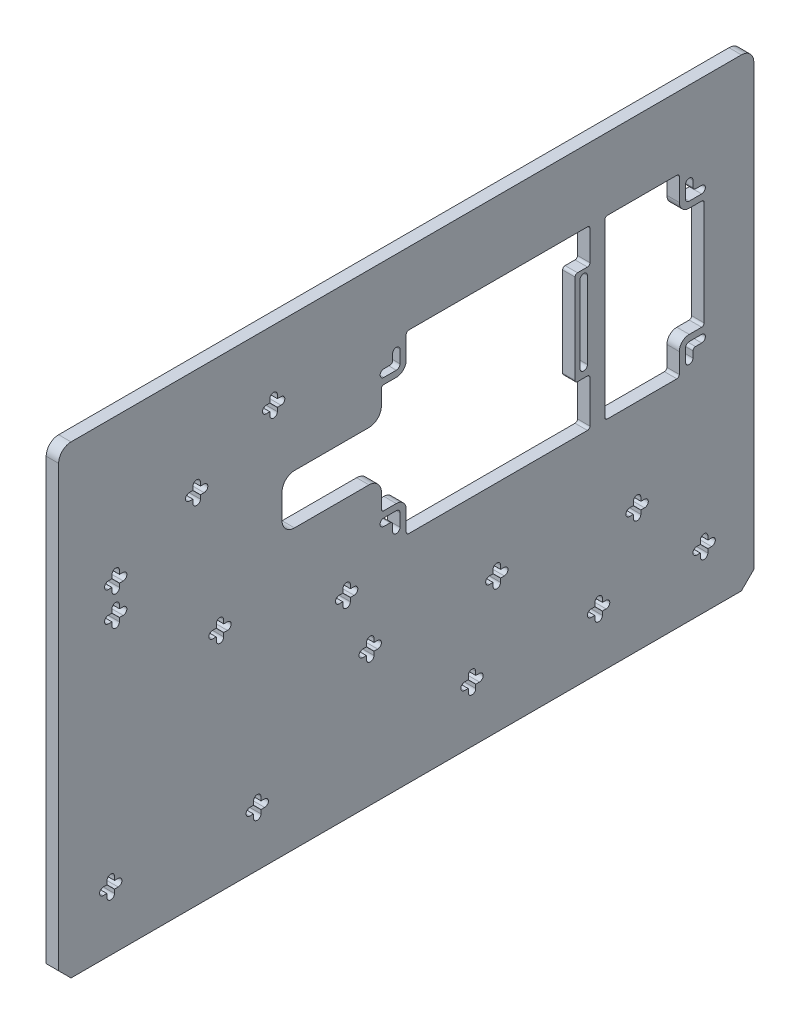
from build123d import *

# Parameters (mm, degrees)
BOSS_EXTRUDE1_DEPTH = 2.5


with BuildPart() as part:
    # Sketch1 → Boss-Extrude1 (new, symmetric)
    with BuildSketch(Plane(origin=(0, 0, 0), x_dir=(0, -1, 0), z_dir=(1, 0, 0))):
        with BuildLine():
            Line((-93.5, 135), (-93.5, -135))
            ThreePointArc((-93.5, -135), (-92.035533906, -138.535533906), (-88.5, -140))
            Line((-88.5, -140), (88.5, -140))
            Line((88.5, -140), (93.5, -135))
            Line((93.5, -135), (93.5, 135))
            Line((93.5, 135), (88.5, 140))
            Line((88.5, 140), (-88.5, 140))
            ThreePointArc((-88.5, 140), (-92.035533906, 138.535533906), (-93.5, 135))
        make_face()
        with BuildLine():
            Line((-12.5, 73), (-12.5, 69))
            ThreePointArc((-12.5, 69), (-12.792893219, 68.292893219), (-13.5, 68))
            Line((-13.5, 68), (-49.5, 68))
            ThreePointArc((-49.5, 68), (-50.207106781, 68.292893219), (-50.5, 69))
            Line((-50.5, 69), (-50.5, 73))
            ThreePointArc((-50.5, 73), (-50.792893219, 73.707106781), (-51.5, 74))
            Line((-51.5, 74), (-63.5, 74))
            ThreePointArc((-63.5, 74), (-64.207106781, 73.707106781), (-64.5, 73))
            Line((-64.5, 73), (-64.5, 1))
            ThreePointArc((-64.5, 1), (-64.207106781, 0.292893219), (-63.5, 0))
            Line((-63.5, 0), (-54.5, 0))
            ThreePointArc((-54.5, 0), (-51.671572875, -1.171572875), (-50.5, -4))
            Line((-50.5, -4), (-50.5, -9))
            ThreePointArc((-50.5, -9), (-50.207106781, -9.707106781), (-49.5, -10))
            Line((-49.5, -10), (-43.5, -10))
            ThreePointArc((-43.5, -10), (-39.964466094, -11.464466094), (-38.5, -15))
            Line((-38.5, -15), (-38.5, -45))
            ThreePointArc((-38.5, -45), (-37.035533906, -48.535533906), (-33.5, -50))
            Line((-33.5, -50), (-23.5, -50))
            ThreePointArc((-23.5, -50), (-19.964466094, -48.535533906), (-18.5, -45))
            Line((-18.5, -45), (-18.5, -15))
            ThreePointArc((-18.5, -15), (-17.035533906, -11.464466094), (-13.5, -10))
            Line((-13.5, -10), (-7.5, -10))
            ThreePointArc((-7.5, -10), (-6.792893219, -9.707106781), (-6.5, -9))
            Line((-6.5, -9), (-6.5, -4))
            ThreePointArc((-6.5, -4), (-5.328427125, -1.171572875), (-2.5, 0))
            Line((-2.5, 0), (5.5, 0))
            ThreePointArc((5.5, 0), (6.207106781, 0.292893219), (6.5, 1))
            Line((6.5, 1), (6.5, 73))
            ThreePointArc((6.5, 73), (6.207106781, 73.707106781), (5.5, 74))
            Line((5.5, 74), (-11.5, 74))
            ThreePointArc((-11.5, 74), (-12.207106781, 73.707106781), (-12.5, 73))
        make_face(mode=Mode.SUBTRACT)
        with BuildLine():
            Line((-47.5, 120), (-49.5, 120))
            ThreePointArc((-49.5, 120), (-50.207106781, 119.707106781), (-50.5, 119))
            Line((-50.5, 119), (-50.5, 114))
            ThreePointArc((-50.5, 114), (-51.671572875, 111.171572875), (-54.5, 110))
            Line((-54.5, 110), (-63.5, 110))
            ThreePointArc((-63.5, 110), (-64.207106781, 109.707106781), (-64.5, 109))
            Line((-64.5, 109), (-64.5, 81))
            ThreePointArc((-64.5, 81), (-64.207106781, 80.292893219), (-63.5, 80))
            Line((-63.5, 80), (5.5, 80))
            ThreePointArc((5.5, 80), (6.207106781, 80.292893219), (6.5, 81))
            Line((6.5, 81), (6.5, 109))
            ThreePointArc((6.5, 109), (6.207106781, 109.707106781), (5.5, 110))
            Line((5.5, 110), (-2.5, 110))
            ThreePointArc((-2.5, 110), (-5.328427125, 111.171572875), (-6.5, 114))
            Line((-6.5, 114), (-6.5, 119))
            ThreePointArc((-6.5, 119), (-6.792893219, 119.707106781), (-7.5, 120))
            Line((-7.5, 120), (-28.5, 120))
            Line((-28.5, 120), (-47.5, 120))
        make_face(mode=Mode.SUBTRACT)
        with BuildLine():
            Line((-47.5, 73), (-16.5, 73))
            ThreePointArc((-16.5, 73), (-15, 71.5), (-16.5, 70))
            Line((-16.5, 70), (-47.5, 70))
            ThreePointArc((-47.5, 70), (-49, 71.5), (-47.5, 73))
        make_face(mode=Mode.SUBTRACT)
        with BuildLine():
            Line((-4, 119), (-4, 114))
            ThreePointArc((-4, 114), (-3.560660172, 112.939339828), (-2.5, 112.5))
            Line((-2.5, 112.5), (2.5, 112.5))
            ThreePointArc((2.5, 112.5), (4, 114), (2.5, 115.5))
            Line((2.5, 115.5), (0, 115.5))
            ThreePointArc((0, 115.5), (-0.707106781, 115.792893219), (-1, 116.5))
            Line((-1, 116.5), (-1, 119))
            ThreePointArc((-1, 119), (-2.5, 120.5), (-4, 119))
        make_face(mode=Mode.SUBTRACT)
        with BuildLine():
            Line((-53, 119), (-53, 114))
            ThreePointArc((-53, 114), (-53.439339828, 112.939339828), (-54.5, 112.5))
            Line((-54.5, 112.5), (-59.5, 112.5))
            ThreePointArc((-59.5, 112.5), (-61, 114), (-59.5, 115.5))
            Line((-59.5, 115.5), (-57, 115.5))
            ThreePointArc((-57, 115.5), (-56.292893219, 115.792893219), (-56, 116.5))
            Line((-56, 116.5), (-56, 119))
            ThreePointArc((-56, 119), (-54.5, 120.5), (-53, 119))
        make_face(mode=Mode.SUBTRACT)
        with BuildLine():
            Line((-54.5, -2.5), (-59.5, -2.5))
            ThreePointArc((-59.5, -2.5), (-61, -4), (-59.5, -5.5))
            Line((-59.5, -5.5), (-57, -5.5))
            ThreePointArc((-57, -5.5), (-56.292893219, -5.792893219), (-56, -6.5))
            Line((-56, -6.5), (-56, -9))
            ThreePointArc((-56, -9), (-54.5, -10.5), (-53, -9))
            Line((-53, -9), (-53, -4))
            ThreePointArc((-53, -4), (-53.439339828, -2.939339828), (-54.5, -2.5))
        make_face(mode=Mode.SUBTRACT)
        with BuildLine():
            Line((2.5, -2.5), (-2.5, -2.5))
            ThreePointArc((-2.5, -2.5), (-3.560660172, -2.939339828), (-4, -4))
            Line((-4, -4), (-4, -9))
            ThreePointArc((-4, -9), (-2.5, -10.5), (-1, -9))
            Line((-1, -9), (-1, -6.5))
            ThreePointArc((-1, -6.5), (-0.707106781, -5.792893219), (0, -5.5))
            Line((0, -5.5), (2.5, -5.5))
            ThreePointArc((2.5, -5.5), (4, -4), (2.5, -2.5))
        make_face(mode=Mode.SUBTRACT)
        with BuildLine():
            Line((36, -13), (37.45, -13))
            ThreePointArc((37.45, -13), (37.485355339, -12.985355339), (37.5, -12.95))
            Line((37.5, -12.95), (37.5, -11.5))
            ThreePointArc((37.5, -11.5), (39, -10), (40.5, -11.5))
            Line((40.5, -11.5), (40.5, -12.95))
            ThreePointArc((40.5, -12.95), (40.514644661, -12.985355339), (40.55, -13))
            Line((40.55, -13), (42, -13))
            ThreePointArc((42, -13), (43.5, -14.5), (42, -16))
            Line((42, -16), (40.55, -16))
            ThreePointArc((40.55, -16), (40.514644661, -16.014644661), (40.5, -16.05))
            Line((40.5, -16.05), (40.5, -17.5))
            ThreePointArc((40.5, -17.5), (39, -19), (37.5, -17.5))
            Line((37.5, -17.5), (37.5, -16.05))
            ThreePointArc((37.5, -16.05), (37.485355339, -16.014644661), (37.45, -16))
            Line((37.45, -16), (36, -16))
            ThreePointArc((36, -16), (34.5, -14.5), (36, -13))
        make_face(mode=Mode.SUBTRACT)
        with BuildLine():
            Line((68, 28), (69.45, 28))
            ThreePointArc((69.45, 28), (69.485355339, 28.014644661), (69.5, 28.05))
            Line((69.5, 28.05), (69.5, 29.5))
            ThreePointArc((69.5, 29.5), (71, 31), (72.5, 29.5))
            Line((72.5, 29.5), (72.5, 28.05))
            ThreePointArc((72.5, 28.05), (72.514644661, 28.014644661), (72.55, 28))
            Line((72.55, 28), (74, 28))
            ThreePointArc((74, 28), (75.5, 26.5), (74, 25))
            Line((74, 25), (72.55, 25))
            ThreePointArc((72.55, 25), (72.514644661, 24.985355339), (72.5, 24.95))
            Line((72.5, 24.95), (72.5, 23.5))
            ThreePointArc((72.5, 23.5), (71, 22), (69.5, 23.5))
            Line((69.5, 23.5), (69.5, 24.95))
            ThreePointArc((69.5, 24.95), (69.485355339, 24.985355339), (69.45, 25))
            Line((69.45, 25), (68, 25))
            ThreePointArc((68, 25), (66.5, 26.5), (68, 28))
        make_face(mode=Mode.SUBTRACT)
        with BuildLine():
            Line((17, -21), (17, -22.45))
            ThreePointArc((17, -22.45), (17.014644661, -22.485355339), (17.05, -22.5))
            Line((17.05, -22.5), (18.5, -22.5))
            ThreePointArc((18.5, -22.5), (20, -24), (18.5, -25.5))
            Line((18.5, -25.5), (17.05, -25.5))
            ThreePointArc((17.05, -25.5), (17.014644661, -25.514644661), (17, -25.55))
            Line((17, -25.55), (17, -27))
            ThreePointArc((17, -27), (15.5, -28.5), (14, -27))
            Line((14, -27), (14, -25.55))
            ThreePointArc((14, -25.55), (13.985355339, -25.514644661), (13.95, -25.5))
            Line((13.95, -25.5), (12.5, -25.5))
            ThreePointArc((12.5, -25.5), (11, -24), (12.5, -22.5))
            Line((12.5, -22.5), (13.95, -22.5))
            ThreePointArc((13.95, -22.5), (13.985355339, -22.485355339), (14, -22.45))
            Line((14, -22.45), (14, -21))
            ThreePointArc((14, -21), (15.5, -19.5), (17, -21))
        make_face(mode=Mode.SUBTRACT)
        with BuildLine():
            Line((73, -57), (73, -58.45))
            ThreePointArc((73, -58.45), (73.014644661, -58.485355339), (73.05, -58.5))
            Line((73.05, -58.5), (74.5, -58.5))
            ThreePointArc((74.5, -58.5), (76, -60), (74.5, -61.5))
            Line((74.5, -61.5), (73.05, -61.5))
            ThreePointArc((73.05, -61.5), (73.014644661, -61.514644661), (73, -61.55))
            Line((73, -61.55), (73, -63))
            ThreePointArc((73, -63), (71.5, -64.5), (70, -63))
            Line((70, -63), (70, -61.55))
            ThreePointArc((70, -61.55), (69.985355339, -61.514644661), (69.95, -61.5))
            Line((69.95, -61.5), (68.5, -61.5))
            ThreePointArc((68.5, -61.5), (67, -60), (68.5, -58.5))
            Line((68.5, -58.5), (69.95, -58.5))
            ThreePointArc((69.95, -58.5), (69.985355339, -58.485355339), (70, -58.45))
            Line((70, -58.45), (70, -57))
            ThreePointArc((70, -57), (71.5, -55.5), (73, -57))
        make_face(mode=Mode.SUBTRACT)
        with BuildLine():
            Line((40.5, 94.5), (41.95, 94.5))
            ThreePointArc((41.95, 94.5), (41.985355339, 94.514644661), (42, 94.55))
            Line((42, 94.55), (42, 96))
            ThreePointArc((42, 96), (43.5, 97.5), (45, 96))
            Line((45, 96), (45, 94.55))
            ThreePointArc((45, 94.55), (45.014644661, 94.514644661), (45.05, 94.5))
            Line((45.05, 94.5), (46.5, 94.5))
            ThreePointArc((46.5, 94.5), (48, 93), (46.5, 91.5))
            Line((46.5, 91.5), (45.05, 91.5))
            ThreePointArc((45.05, 91.5), (45.014644661, 91.485355339), (45, 91.45))
            Line((45, 91.45), (45, 90))
            ThreePointArc((45, 90), (43.5, 88.5), (42, 90))
            Line((42, 90), (42, 91.45))
            ThreePointArc((42, 91.45), (41.985355339, 91.485355339), (41.95, 91.5))
            Line((41.95, 91.5), (40.5, 91.5))
            ThreePointArc((40.5, 91.5), (39, 93), (40.5, 94.5))
        make_face(mode=Mode.SUBTRACT)
        with BuildLine():
            Line((67.5, 121.5), (68.95, 121.5))
            ThreePointArc((68.95, 121.5), (68.985355339, 121.514644661), (69, 121.55))
            Line((69, 121.55), (69, 123))
            ThreePointArc((69, 123), (70.5, 124.5), (72, 123))
            Line((72, 123), (72, 121.55))
            ThreePointArc((72, 121.55), (72.014644661, 121.514644661), (72.05, 121.5))
            Line((72.05, 121.5), (73.5, 121.5))
            ThreePointArc((73.5, 121.5), (75, 120), (73.5, 118.5))
            Line((73.5, 118.5), (72.05, 118.5))
            ThreePointArc((72.05, 118.5), (72.014644661, 118.485355339), (72, 118.45))
            Line((72, 118.45), (72, 117))
            ThreePointArc((72, 117), (70.5, 115.5), (69, 117))
            Line((69, 117), (69, 118.45))
            ThreePointArc((69, 118.45), (68.985355339, 118.485355339), (68.95, 118.5))
            Line((68.95, 118.5), (67.5, 118.5))
            ThreePointArc((67.5, 118.5), (66, 120), (67.5, 121.5))
        make_face(mode=Mode.SUBTRACT)
        with BuildLine():
            Line((-34.5, -120), (-34.5, -118.55))
            ThreePointArc((-34.5, -118.55), (-34.485355339, -118.514644661), (-34.45, -118.5))
            Line((-34.45, -118.5), (-33, -118.5))
            ThreePointArc((-33, -118.5), (-31.5, -117), (-33, -115.5))
            Line((-33, -115.5), (-34.45, -115.5))
            ThreePointArc((-34.45, -115.5), (-34.485355339, -115.485355339), (-34.5, -115.45))
            Line((-34.5, -115.45), (-34.5, -114))
            ThreePointArc((-34.5, -114), (-36, -112.5), (-37.5, -114))
            Line((-37.5, -114), (-37.5, -115.45))
            ThreePointArc((-37.5, -115.45), (-37.514644661, -115.485355339), (-37.55, -115.5))
            Line((-37.55, -115.5), (-39, -115.5))
            ThreePointArc((-39, -115.5), (-40.5, -117), (-39, -118.5))
            Line((-39, -118.5), (-37.55, -118.5))
            ThreePointArc((-37.55, -118.5), (-37.514644661, -118.514644661), (-37.5, -118.55))
            Line((-37.5, -118.55), (-37.5, -120))
            ThreePointArc((-37.5, -120), (-36, -121.5), (-34.5, -120))
        make_face(mode=Mode.SUBTRACT)
        with BuildLine():
            Line((-22.5, -120), (-22.5, -118.55))
            ThreePointArc((-22.5, -118.55), (-22.485355339, -118.514644661), (-22.45, -118.5))
            Line((-22.45, -118.5), (-21, -118.5))
            ThreePointArc((-21, -118.5), (-19.5, -117), (-21, -115.5))
            Line((-21, -115.5), (-22.45, -115.5))
            ThreePointArc((-22.45, -115.5), (-22.485355339, -115.485355339), (-22.5, -115.45))
            Line((-22.5, -115.45), (-22.5, -114))
            ThreePointArc((-22.5, -114), (-24, -112.5), (-25.5, -114))
            Line((-25.5, -114), (-25.5, -115.45))
            ThreePointArc((-25.5, -115.45), (-25.514644661, -115.485355339), (-25.55, -115.5))
            Line((-25.55, -115.5), (-27, -115.5))
            ThreePointArc((-27, -115.5), (-28.5, -117), (-27, -118.5))
            Line((-27, -118.5), (-25.55, -118.5))
            ThreePointArc((-25.55, -118.5), (-25.514644661, -118.514644661), (-25.5, -118.55))
            Line((-25.5, -118.55), (-25.5, -120))
            ThreePointArc((-25.5, -120), (-24, -121.5), (-22.5, -120))
        make_face(mode=Mode.SUBTRACT)
        with BuildLine():
            Line((36, 38), (37.45, 38))
            ThreePointArc((37.45, 38), (37.485355339, 38.014644661), (37.5, 38.05))
            Line((37.5, 38.05), (37.5, 39.5))
            ThreePointArc((37.5, 39.5), (39, 41), (40.5, 39.5))
            Line((40.5, 39.5), (40.5, 38.05))
            ThreePointArc((40.5, 38.05), (40.514644661, 38.014644661), (40.55, 38))
            Line((40.55, 38), (42, 38))
            ThreePointArc((42, 38), (43.5, 36.5), (42, 35))
            Line((42, 35), (40.55, 35))
            ThreePointArc((40.55, 35), (40.514644661, 34.985355339), (40.5, 34.95))
            Line((40.5, 34.95), (40.5, 33.5))
            ThreePointArc((40.5, 33.5), (39, 32), (37.5, 33.5))
            Line((37.5, 33.5), (37.5, 34.95))
            ThreePointArc((37.5, 34.95), (37.485355339, 34.985355339), (37.45, 35))
            Line((37.45, 35), (36, 35))
            ThreePointArc((36, 35), (34.5, 36.5), (36, 38))
        make_face(mode=Mode.SUBTRACT)
        with BuildLine():
            Line((68, 79), (69.45, 79))
            ThreePointArc((69.45, 79), (69.485355339, 79.014644661), (69.5, 79.05))
            Line((69.5, 79.05), (69.5, 80.5))
            ThreePointArc((69.5, 80.5), (71, 82), (72.5, 80.5))
            Line((72.5, 80.5), (72.5, 79.05))
            ThreePointArc((72.5, 79.05), (72.514644661, 79.014644661), (72.55, 79))
            Line((72.55, 79), (74, 79))
            ThreePointArc((74, 79), (75.5, 77.5), (74, 76))
            Line((74, 76), (72.55, 76))
            ThreePointArc((72.55, 76), (72.514644661, 75.985355339), (72.5, 75.95))
            Line((72.5, 75.95), (72.5, 74.5))
            ThreePointArc((72.5, 74.5), (71, 73), (69.5, 74.5))
            Line((69.5, 74.5), (69.5, 75.95))
            ThreePointArc((69.5, 75.95), (69.485355339, 75.985355339), (69.45, 76))
            Line((69.45, 76), (68, 76))
            ThreePointArc((68, 76), (66.5, 77.5), (68, 79))
        make_face(mode=Mode.SUBTRACT)
        with BuildLine():
            Line((3.75, -72), (3.75, -73.45))
            ThreePointArc((3.75, -73.45), (3.764644661, -73.485355339), (3.8, -73.5))
            Line((3.8, -73.5), (5.25, -73.5))
            ThreePointArc((5.25, -73.5), (6.75, -75), (5.25, -76.5))
            Line((5.25, -76.5), (3.8, -76.5))
            ThreePointArc((3.8, -76.5), (3.764644661, -76.514644661), (3.75, -76.55))
            Line((3.75, -76.55), (3.75, -78))
            ThreePointArc((3.75, -78), (2.25, -79.5), (0.75, -78))
            Line((0.75, -78), (0.75, -76.55))
            ThreePointArc((0.75, -76.55), (0.735355339, -76.514644661), (0.7, -76.5))
            Line((0.7, -76.5), (-0.75, -76.5))
            ThreePointArc((-0.75, -76.5), (-2.25, -75), (-0.75, -73.5))
            Line((-0.75, -73.5), (0.7, -73.5))
            ThreePointArc((0.7, -73.5), (0.735355339, -73.485355339), (0.75, -73.45))
            Line((0.75, -73.45), (0.75, -72))
            ThreePointArc((0.75, -72), (2.25, -70.5), (3.75, -72))
        make_face(mode=Mode.SUBTRACT)
        with BuildLine():
            Line((71.25, -116), (71.25, -117.45))
            ThreePointArc((71.25, -117.45), (71.264644661, -117.485355339), (71.3, -117.5))
            Line((71.3, -117.5), (72.75, -117.5))
            ThreePointArc((72.75, -117.5), (74.25, -119), (72.75, -120.5))
            Line((72.75, -120.5), (71.3, -120.5))
            ThreePointArc((71.3, -120.5), (71.264644661, -120.514644661), (71.25, -120.55))
            Line((71.25, -120.55), (71.25, -122))
            ThreePointArc((71.25, -122), (69.75, -123.5), (68.25, -122))
            Line((68.25, -122), (68.25, -120.55))
            ThreePointArc((68.25, -120.55), (68.235355339, -120.514644661), (68.2, -120.5))
            Line((68.2, -120.5), (66.75, -120.5))
            ThreePointArc((66.75, -120.5), (65.25, -119), (66.75, -117.5))
            Line((66.75, -117.5), (68.2, -117.5))
            ThreePointArc((68.2, -117.5), (68.235355339, -117.485355339), (68.25, -117.45))
            Line((68.25, -117.45), (68.25, -116))
            ThreePointArc((68.25, -116), (69.75, -114.5), (71.25, -116))
        make_face(mode=Mode.SUBTRACT)
        with BuildLine():
            Line((-68.5, -54.9), (-67.05, -54.9))
            ThreePointArc((-67.05, -54.9), (-67.014644661, -54.914644661), (-67, -54.95))
            Line((-67, -54.95), (-67, -56.4))
            ThreePointArc((-67, -56.4), (-65.5, -57.9), (-64, -56.4))
            Line((-64, -56.4), (-64, -54.95))
            ThreePointArc((-64, -54.95), (-63.985355339, -54.914644661), (-63.95, -54.9))
            Line((-63.95, -54.9), (-62.5, -54.9))
            ThreePointArc((-62.5, -54.9), (-61, -53.4), (-62.5, -51.9))
            Line((-62.5, -51.9), (-63.95, -51.9))
            ThreePointArc((-63.95, -51.9), (-63.985355339, -51.885355339), (-64, -51.85))
            Line((-64, -51.85), (-64, -50.4))
            ThreePointArc((-64, -50.4), (-65.5, -48.9), (-67, -50.4))
            Line((-67, -50.4), (-67, -51.85))
            ThreePointArc((-67, -51.85), (-67.014644661, -51.885355339), (-67.05, -51.9))
            Line((-67.05, -51.9), (-68.5, -51.9))
            ThreePointArc((-68.5, -51.9), (-70, -53.4), (-68.5, -54.9))
        make_face(mode=Mode.SUBTRACT)
        with BuildLine():
            Line((-53.5, -85.9), (-52.05, -85.9))
            ThreePointArc((-52.05, -85.9), (-52.014644661, -85.914644661), (-52, -85.95))
            Line((-52, -85.95), (-52, -87.4))
            ThreePointArc((-52, -87.4), (-50.5, -88.9), (-49, -87.4))
            Line((-49, -87.4), (-49, -85.95))
            ThreePointArc((-49, -85.95), (-48.985355339, -85.914644661), (-48.95, -85.9))
            Line((-48.95, -85.9), (-47.5, -85.9))
            ThreePointArc((-47.5, -85.9), (-46, -84.4), (-47.5, -82.9))
            Line((-47.5, -82.9), (-48.95, -82.9))
            ThreePointArc((-48.95, -82.9), (-48.985355339, -82.885355339), (-49, -82.85))
            Line((-49, -82.85), (-49, -81.4))
            ThreePointArc((-49, -81.4), (-50.5, -79.9), (-52, -81.4))
            Line((-52, -81.4), (-52, -82.85))
            ThreePointArc((-52, -82.85), (-52.014644661, -82.885355339), (-52.05, -82.9))
            Line((-52.05, -82.9), (-53.5, -82.9))
            ThreePointArc((-53.5, -82.9), (-55, -84.4), (-53.5, -85.9))
        make_face(mode=Mode.SUBTRACT)
    extrude(amount=BOSS_EXTRUDE1_DEPTH, both=True)


solid = part.part
